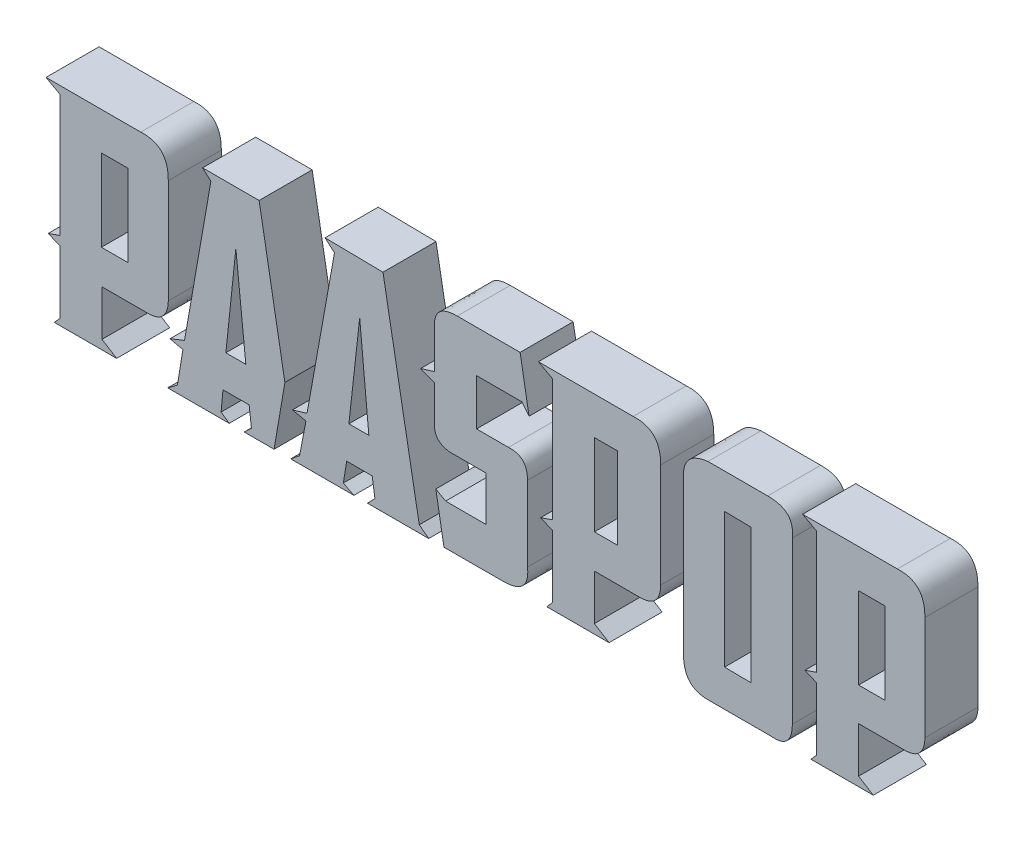
from build123d import *

# Parameters (mm, degrees)
BOSS_EXTRUDE1_DEPTH   = 10
MODEL_W               = 4.4
MODEL_H               = 15.4
BOSS_EXTRUDE1_2_DEPTH = 10
BOSS_EXTRUDE1_3_DEPTH = 10
MODEL_W_2             = 5
BOSS_EXTRUDE1_4_DEPTH = 10
BOSS_EXTRUDE1_5_DEPTH = 10
BOSS_EXTRUDE1_6_DEPTH = 10
BOSS_EXTRUDE1_7_DEPTH = 10


with BuildPart() as part:
    # Model → Boss-Extrude1 (new body)
    with BuildSketch(Plane.XY):
        with BuildLine():
            Line((89.802370268, -74.632247239), (88.270151162, -65.887314442))
            Line((88.270151162, -65.887314442), (90.109114907, -66.95))
            Line((90.109114907, -66.95), (97.75, -66.95))
            Line((97.75, -66.95), (97.75, -58.55))
            Line((97.75, -58.55), (90.996777975, -58.55))
            add(Edge.make_bspline(
                [(90.996777975, -58.55), (88.020495925, -58.280254726), (87.981334319, -55.538942312)],
                knots=[5, 5, 5, 6, 6, 6], degree=2))
            add(Edge.make_bspline(
                [(87.981334319, -55.538942312), (87.942172713, -52.797629897), (87.981334319, -48.687854259)],
                knots=[6, 6, 6, 7, 7, 7], degree=2))
            Line((87.981334319, -48.687854259), (85.391839562, -47.670748997))
            Line((85.391839562, -47.670748997), (88.05, -46.849451765))
            Line((88.05, -46.849451765), (88.05, -39.917847516))
            add(Edge.make_bspline(
                [(88.05, -39.917847516), (87.589718259, -35.65), (92.28911097, -35.65)],
                knots=[10, 10, 10, 11, 11, 11], degree=2))
            add(Edge.make_bspline(
                [(92.28911097, -35.65), (96.988503681, -35.65), (104.155077565, -35.65)],
                knots=[11, 11, 11, 12, 12, 12], degree=2))
            Line((104.155077565, -35.65), (105.83902662, -45.239271253))
            Line((105.83902662, -45.239271253), (104.468370413, -43.55))
            Line((104.468370413, -43.55), (95.95, -43.55))
            Line((95.95, -43.55), (95.95, -52.25))
            Line((95.95, -52.25), (101.962027633, -52.25))
            add(Edge.make_bspline(
                [(101.962027633, -52.25), (105.55, -52.057945352), (105.55, -55.837040324)],
                knots=[17, 17, 17, 18, 18, 18], degree=2))
            add(Edge.make_bspline(
                [(105.55, -55.837040324), (105.55, -59.616135296), (105.55, -69.993960865)],
                knots=[18, 18, 18, 19, 19, 19], degree=2))
            add(Edge.make_bspline(
                [(105.55, -69.993960865), (106.066548566, -74.615030364), (100.93637819, -74.615030364)],
                knots=[19, 19, 19, 20, 20, 20], degree=2))
            add(Edge.make_bspline(
                [(100.93637819, -74.615030364), (95.806207814, -74.615030364), (89.802370268, -74.632247239)],
                knots=[20, 20, 20, 21, 21, 21], degree=2))
        make_face()
    extrude(amount=BOSS_EXTRUDE1_DEPTH)


with BuildPart() as body_2:
    # Model → Boss-Extrude1 2 (new body)
    with BuildSketch(Plane.XY):
        with BuildLine():
            Line((107.601298886, -35.45), (125.458991188, -35.45))
            add(Edge.make_bspline(
                [(125.458991188, -35.45), (130.65, -35.175101229), (130.65, -40.775210876)],
                knots=[1, 1, 1, 2, 2, 2], degree=2))
            add(Edge.make_bspline(
                [(130.65, -40.775210876), (130.65, -46.375320523), (130.65, -60.395175444)],
                knots=[2, 2, 2, 3, 3, 3], degree=2))
            add(Edge.make_bspline(
                [(130.65, -60.395175444), (130.549999958, -64.35), (126.751324183, -64.35)],
                knots=[3, 3, 3, 4, 4, 4], degree=2))
            add(Edge.make_bspline(
                [(126.751324183, -64.35), (122.952648409, -64.35), (118.15, -64.35)],
                knots=[4, 4, 4, 5, 5, 5], degree=2))
            Line((118.15, -64.35), (118.15, -72.926889339))
            Line((118.15, -72.926889339), (120.916244901, -74.65))
            Line((120.916244901, -74.65), (109.167763123, -74.65))
            Line((109.167763123, -74.65), (110.25, -73.435990216))
            Line((110.25, -73.435990216), (110.25, -61.648346833))
            Line((110.25, -61.648346833), (108.017788462, -60.708468291))
            Line((108.017788462, -60.708468291), (110.25, -59.925236173))
            Line((110.25, -59.925236173), (110.25, -36.89821189))
            Line((110.25, -36.89821189), (107.601298886, -35.45))
        make_face()
        with Locations((120.35, -50.25)):
            Rectangle(MODEL_W, MODEL_H, mode=Mode.SUBTRACT)
    extrude(amount=BOSS_EXTRUDE1_2_DEPTH)


with BuildPart() as body_3:
    # Model → Boss-Extrude1 3 (new body)
    with BuildSketch(Plane.XY):
        with BuildLine():
            Line((139.55716932, -74.65), (151.462297521, -74.65))
            add(Edge.make_bspline(
                [(151.462297521, -74.65), (155.45, -75.054430949), (155.45, -70.694438823)],
                knots=[1, 1, 1, 2, 2, 2], degree=2))
            add(Edge.make_bspline(
                [(155.45, -70.694438823), (155.45, -66.334446697), (155.45, -40.331140363)],
                knots=[2, 2, 2, 3, 3, 3], degree=2))
            add(Edge.make_bspline(
                [(155.45, -40.331140363), (156.005043808, -35.75), (150.809604089, -35.75)],
                knots=[3, 3, 3, 4, 4, 4], degree=2))
            add(Edge.make_bspline(
                [(150.809604089, -35.75), (145.61416437, -35.75), (139.55716932, -35.75)],
                knots=[4, 4, 4, 5, 5, 5], degree=2))
            add(Edge.make_bspline(
                [(139.55716932, -35.75), (134.95, -36.310548822), (134.95, -40.200601677)],
                knots=[5, 5, 5, 6, 6, 6], degree=2))
            add(Edge.make_bspline(
                [(134.95, -40.200601677), (134.95, -44.090654532), (134.95, -69.780668018)],
                knots=[6, 6, 6, 7, 7, 7], degree=2))
            add(Edge.make_bspline(
                [(134.95, -69.780668018), (135.066638508, -74.65), (139.55716932, -74.65)],
                knots=[7, 7, 7, 8, 8, 8], degree=2))
        make_face()
        Polygon((142.690097794, -67.751932061), (147.689717496, -67.81359919), (147.689717496, -42.41166713), (142.690097794, -42.35), align=None, mode=Mode.SUBTRACT)
    extrude(amount=BOSS_EXTRUDE1_3_DEPTH)


with BuildPart() as body_4:
    # Model → Boss-Extrude1 4 (new body)
    with BuildSketch(Plane.XY):
        with BuildLine():
            Line((14.801298886, -35.45), (32.658991188, -35.45))
            add(Edge.make_bspline(
                [(32.658991188, -35.45), (37.85, -35.175101229), (37.85, -40.775210876)],
                knots=[1, 1, 1, 2, 2, 2], degree=2))
            add(Edge.make_bspline(
                [(37.85, -40.775210876), (37.85, -46.375320523), (37.85, -60.395175444)],
                knots=[2, 2, 2, 3, 3, 3], degree=2))
            add(Edge.make_bspline(
                [(37.85, -60.395175444), (37.749999958, -64.35), (33.951324183, -64.35)],
                knots=[3, 3, 3, 4, 4, 4], degree=2))
            add(Edge.make_bspline(
                [(33.951324183, -64.35), (30.152648409, -64.35), (25.35, -64.35)],
                knots=[4, 4, 4, 5, 5, 5], degree=2))
            Line((25.35, -64.35), (25.35, -72.926889339))
            Line((25.35, -72.926889339), (28.116244901, -74.65))
            Line((28.116244901, -74.65), (16.367763123, -74.65))
            Line((16.367763123, -74.65), (17.45, -73.435990216))
            Line((17.45, -73.435990216), (17.45, -61.648346833))
            Line((17.45, -61.648346833), (15.217788462, -60.708468291))
            Line((15.217788462, -60.708468291), (17.45, -59.925236173))
            Line((17.45, -59.925236173), (17.45, -36.89821189))
            Line((17.45, -36.89821189), (14.801298886, -35.45))
        make_face()
        with Locations((27.75, -50.25)):
            Rectangle(MODEL_W_2, MODEL_H, mode=Mode.SUBTRACT)
    extrude(amount=BOSS_EXTRUDE1_4_DEPTH)


with BuildPart() as body_5:
    # Model → Boss-Extrude1 5 (new body)
    with BuildSketch(Plane.XY):
        with BuildLine():
            Line((157.401298886, -35.45), (175.258991188, -35.45))
            add(Edge.make_bspline(
                [(175.258991188, -35.45), (180.45, -35.175101229), (180.45, -40.775210876)],
                knots=[1, 1, 1, 2, 2, 2], degree=2))
            add(Edge.make_bspline(
                [(180.45, -40.775210876), (180.45, -46.375320523), (180.45, -60.395175444)],
                knots=[2, 2, 2, 3, 3, 3], degree=2))
            add(Edge.make_bspline(
                [(180.45, -60.395175444), (180.349999958, -64.35), (176.551324183, -64.35)],
                knots=[3, 3, 3, 4, 4, 4], degree=2))
            add(Edge.make_bspline(
                [(176.551324183, -64.35), (172.752648409, -64.35), (167.95, -64.35)],
                knots=[4, 4, 4, 5, 5, 5], degree=2))
            Line((167.95, -64.35), (167.95, -72.926889339))
            Line((167.95, -72.926889339), (170.716244901, -74.65))
            Line((170.716244901, -74.65), (158.967763123, -74.65))
            Line((158.967763123, -74.65), (160.05, -73.435990216))
            Line((160.05, -73.435990216), (160.05, -61.648346833))
            Line((160.05, -61.648346833), (157.817788462, -60.708468291))
            Line((157.817788462, -60.708468291), (160.05, -59.925236173))
            Line((160.05, -59.925236173), (160.05, -36.89821189))
            Line((160.05, -36.89821189), (157.401298886, -35.45))
        make_face()
        with Locations((170.45, -50.35)):
            Rectangle(MODEL_W_2, MODEL_H, mode=Mode.SUBTRACT)
    extrude(amount=BOSS_EXTRUDE1_5_DEPTH)


with BuildPart() as body_6:
    # Model → Boss-Extrude1 6 (new body)
    with BuildSketch(Plane.XY):
        Polygon((37.736993919, -74.65), (49.328829272, -74.65), (47.801526641, -73.570656207), (48.153981094, -69.75), (53.088343441, -69.75), (53.519121106, -73.374848178), (52.148464899, -74.65), (57.787736152, -74.65), (59.82413966, -62.725674761), (54.968100525, -35.45), (44.316143714, -35.45), (45.882607951, -36.839853245), (40.909083998, -65.319939271), (38.167771584, -66.421263496), (40.595791151, -66.971925609), (39.577589397, -73.278143978), align=None)
        Polygon((48.702243577, -63.45), (52.461757746, -63.45), (50.582000662, -45.48787675), align=None, mode=Mode.SUBTRACT)
    extrude(amount=BOSS_EXTRUDE1_6_DEPTH)


with BuildPart() as body_7:
    # Model → Boss-Extrude1 7 (new body)
    with BuildSketch(Plane.XY):
        Polygon((60.920664625, -74.65), (72.825792826, -74.65), (70.841604793, -73.635925551), (71.468190488, -69.75), (76.272014148, -69.75), (76.794168893, -73.192094017), (75.38435108, -74.65), (86.923970959, -74.65), (85.148644824, -73.292397661), (78.308417656, -35.488394076), (67.395383472, -35.331747653), (69.170709607, -36.89821189), (64.001377625, -65.668938375), (61.233957473, -66.504385968), (63.792515727, -67.026540714), (62.591559812, -73.292397661), align=None)
        Polygon((71.885914284, -63.45), (75.645428453, -63.45), (73.922317792, -45.122368428), align=None, mode=Mode.SUBTRACT)
    extrude(amount=BOSS_EXTRUDE1_7_DEPTH)


solid = Compound([part.part, body_2.part, body_3.part, body_4.part, body_5.part, body_6.part, body_7.part])
